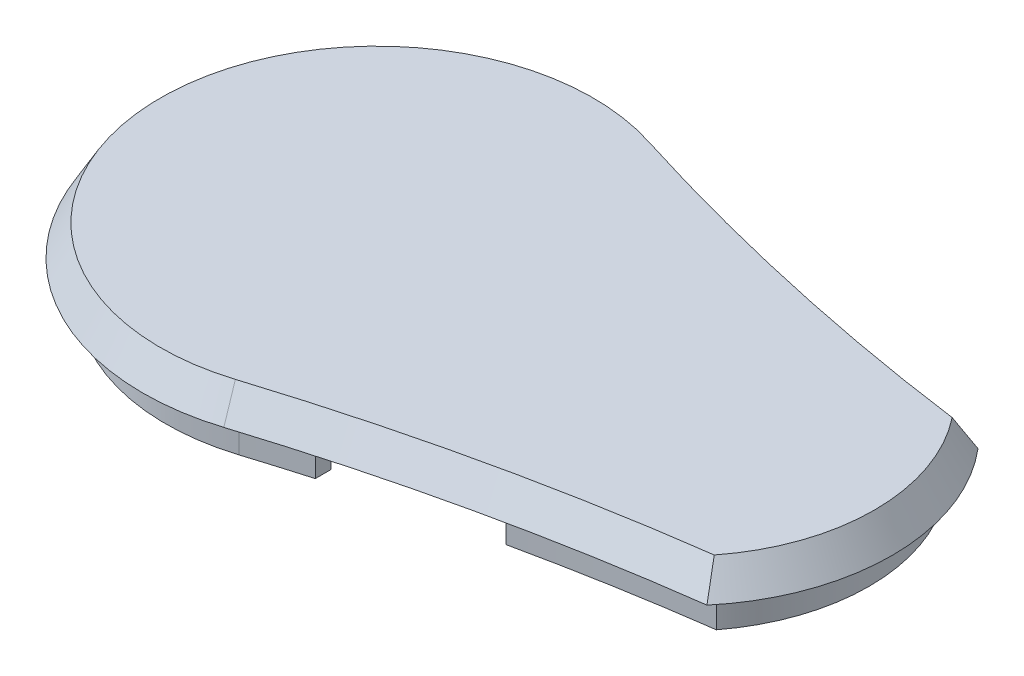
from build123d import *
from build123d.topology import SkipClean

# Parameters (mm, degrees)
BOSS_EXTRUDE1_DEPTH = 4
BOSS_EXTRUDE1_DRAFT = 30
BOSS_EXTRUDE2_DEPTH = 5
CUT_EXTRUDE1_START  = -2
CUT_EXTRUDE1_DEPTH  = 2
SKETCH4_W           = 20
SKETCH4_H           = 65
CUT_EXTRUDE2_DEPTH  = 5


with BuildPart() as part:
    # Sketch1 → Boss-Extrude1 (with draft: the straight prism first)
    with BuildSketch(Plane(origin=(0, 0, 0), x_dir=(1, 0, 0), z_dir=(0, 1, 0))):
        with BuildLine():
            ThreePointArc((9.197775679, 29.236469294), (-30.649147039, 0), (9.197775679, -29.236469294))
            ThreePointArc((9.197775679, -29.236469294), (34.853272727, -22.372060148), (61.006889531, -17.755462936))
            ThreePointArc((61.006889531, -17.755462936), (67.505378962, 0), (61.006889531, 17.755462936))
            ThreePointArc((61.006889531, 17.755462936), (34.853272727, 22.372060148), (9.197775679, 29.236469294))
        make_face()
    extrude(amount=BOSS_EXTRUDE1_DEPTH)
    # Boss-Extrude1: the draft: its side faces are tilted about the plane it starts from
    boss_extrude1_sides = [part.faces().sort_by_distance(p)[0] for p in [
        (34.853272727, 2, -22.372060148),
        (-30.649147039, 2, 0),
        (34.853272727, 2, 22.372060148),
        (67.505378962, 2, 0),
    ]]
    draft(boss_extrude1_sides, Plane(origin=(0, 0, 0), x_dir=(1, 0, 0), z_dir=(0, 1, 0)), BOSS_EXTRUDE1_DRAFT)

    # Sketch2 → Boss-Extrude2 (add)
    with BuildSketch(Plane.XZ):
        with BuildLine():
            Line((27.868957123, -22), (23.561105774, -22))
            ThreePointArc((23.561105774, -22), (15.901219685, -24.089426048), (8.297478943, -26.374745026))
            ThreePointArc((8.297478943, -26.374745026), (-27.649147039, 0), (8.297478943, 26.374745026))
            ThreePointArc((8.297478943, 26.374745026), (15.901219685, 24.089426048), (23.561105774, 22))
            Line((23.561105774, 22), (27.868957123, 22))
            ThreePointArc((27.868957123, 22), (29.782374284, 21.619397663), (31.404491029, 20.535533906))
            Line((31.404491029, 20.535533906), (32, 19.940024934))
            ThreePointArc((32, 19.940024934), (45.655548758, 17.131412627), (59.423772768, 14.940905244))
            ThreePointArc((59.423772768, 14.940905244), (64.505378962, 0), (59.423772768, -14.940905244))
            ThreePointArc((59.423772768, -14.940905244), (45.655548758, -17.131412627), (32, -19.940024934))
            Line((32, -19.940024934), (31.404491029, -20.535533906))
            ThreePointArc((31.404491029, -20.535533906), (29.782374284, -21.619397663), (27.868957123, -22))
        make_face()
        with BuildLine():
            Line((27.868957123, -20), (23.306693962, -20))
            ThreePointArc((23.306693962, -20), (15.472865522, -22.131699291), (7.697281119, -24.466928847))
            ThreePointArc((7.697281119, -24.466928847), (-25.649147039, 0), (7.697281119, 24.466928847))
            ThreePointArc((7.697281119, 24.466928847), (15.472865522, 22.131699291), (23.306693962, 20))
            Line((23.306693962, 20), (27.868957123, 20))
            ThreePointArc((27.868957123, 20), (29.01700742, 19.771638598), (29.990277466, 19.121320344))
            Line((29.990277466, 19.121320344), (30.991752856, 18.119844953))
            ThreePointArc((30.991752856, 18.119844953), (44.598722443, 15.291926863), (58.318334372, 13.074047119))
            ThreePointArc((58.318334372, 13.074047119), (62.505378962, 0), (58.318334372, -13.074047119))
            ThreePointArc((58.318334372, -13.074047119), (44.598722443, -15.291926863), (30.991752856, -18.119844953))
            Line((30.991752856, -18.119844953), (29.990277466, -19.121320344))
            ThreePointArc((29.990277466, -19.121320344), (29.01700742, -19.771638598), (27.868957123, -20))
        make_face(mode=Mode.SUBTRACT)
    extrude(amount=BOSS_EXTRUDE2_DEPTH)

    # Sketch3 → Cut-Extrude1 (cut)
    with SkipClean():  # the faces are left unmerged after this step: merging them gives an invalid solid
        with BuildSketch(Plane.XZ.offset(CUT_EXTRUDE1_START)):
            with BuildLine():
                Line((23.306693962, -20), (27.868957123, -20))
                ThreePointArc((27.868957123, -20), (29.01700742, -19.771638598), (29.990277466, -19.121320344))
                Line((29.990277466, -19.121320344), (30.991752856, -18.119844953))
                ThreePointArc((30.991752856, -18.119844953), (44.598722443, -15.291926863), (58.318334372, -13.074047119))
                ThreePointArc((58.318334372, -13.074047119), (62.505378962, 0), (58.318334372, 13.074047119))
                ThreePointArc((58.318334372, 13.074047119), (44.598722443, 15.291926863), (30.991752856, 18.119844953))
                Line((30.991752856, 18.119844953), (29.990277466, 19.121320344))
                ThreePointArc((29.990277466, 19.121320344), (29.01700742, 19.771638598), (27.868957123, 20))
                Line((27.868957123, 20), (23.306693962, 20))
                ThreePointArc((23.306693962, 20), (15.472865522, 22.131699291), (7.697281119, 24.466928847))
                ThreePointArc((7.697281119, 24.466928847), (-25.649147039, 0), (7.697281119, -24.466928847))
                ThreePointArc((7.697281119, -24.466928847), (15.472865522, -22.131699291), (23.306693962, -20))
            make_face()
        extrude(amount=CUT_EXTRUDE1_DEPTH, mode=Mode.SUBTRACT)

    # Sketch4 → Cut-Extrude2 (cut)
    with SkipClean():  # the faces are left unmerged after this step: merging them gives an invalid solid
        with BuildSketch(Plane.XZ.offset(5)):
            with Locations((26, 0)):
                Rectangle(SKETCH4_W, SKETCH4_H)
        extrude(amount=-CUT_EXTRUDE2_DEPTH, mode=Mode.SUBTRACT)


solid = part.part
